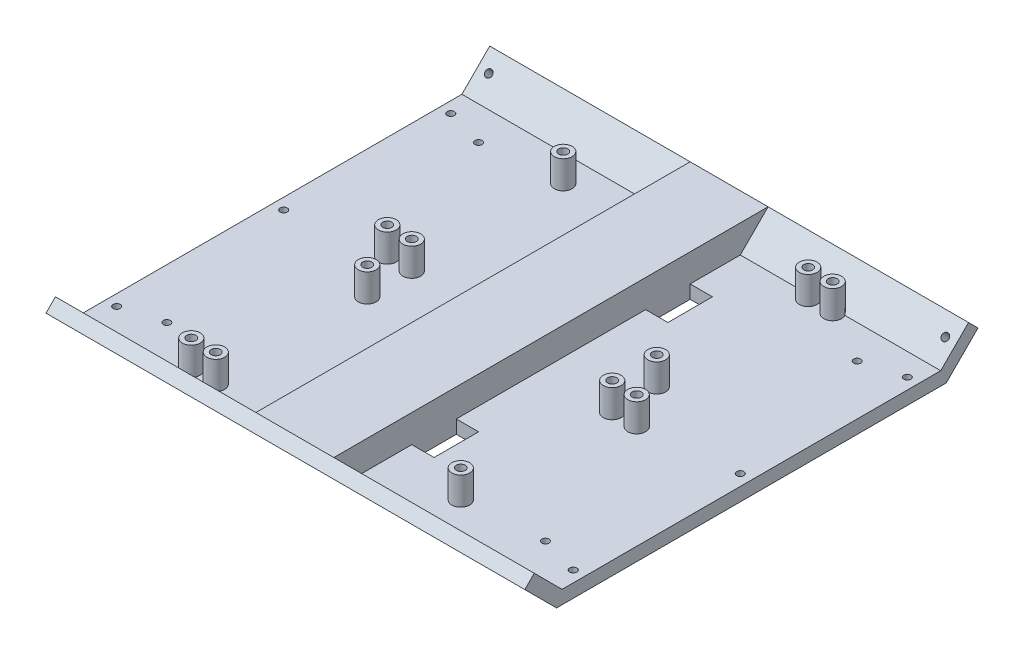
from build123d import *

# Parameters (mm, degrees)
MAIN_DEPTH                                   = 107.5
F_3_0MM_DOWEL_HOLE1_D                        = 3.2
F_3_0MM_DOWEL_HOLE1_ON_FACE_2_D              = 3.2
F_3_0MM_DOWEL_HOLE1_ON_FACE_3_D              = 3.2
F_3_0MM_DOWEL_HOLE1_ON_FACE_4_D              = 3.2
SKETCH4_W                                    = 10
SKETCH4_H                                    = 20
BATTERY_STRAP_CUTOUT_DEPTH                   = 149.539775596
BATTERY_STRAP_CUTOUT_MIRROR_AT_THE_S_2_W     = 10
BATTERY_STRAP_CUTOUT_MIRROR_AT_THE_S_2_H     = 20
BATTERY_STRAP_CUTOUT_MIRROR_AT_THE_S_3_DEPTH = 149.539775596
BATTERY_MOUNT_DEPTH                          = 17.5
PCB_MOUNTS_REACH                             = 151.165
SKETCH7_R                                    = 4
SKETCH8_R                                    = 2.05
PCB_MOUNT_INSERTS_DEPTH                      = 5.7
SKETCH9_R                                    = 1.6
FEET_SCREW_HOLE_DEPTH                        = 150.164556561
MIRROR1_AT_THE_SECOND_PLANE_COPY_1_SKETC_R   = 1.6
MIRROR1_AT_THE_SECOND_PLANE_COPY_1_DEPTH     = 150.164556561


with BuildPart() as part:
    # Sketch2 → Main (new, symmetric)
    with BuildSketch(Plane(origin=(0, 0, 0), x_dir=(0, 0, -1), z_dir=(1, 0, 0))):
        Polygon((-85, 0), (85, 0), (97.5, 12.5), (101.742640687, 8.257359313), (87.485281374, -6), (-87.485281374, -6), (-101.742640687, 8.257359313), (-97.5, 12.5), align=None)
    extrude(amount=MAIN_DEPTH, both=True)

    # Ø3.0mm Dowel Hole1 (through all)
    with Locations(Plane(origin=(-102.5, 7.071067812, -92.071067812), x_dir=(0, 0.707106781187, -0.707106781187), z_dir=(0, 0.707106781187, 0.707106781187))):
        with Locations((0, 0)):
            Hole(F_3_0MM_DOWEL_HOLE1_D / 2)

    # Ø3.0mm Dowel Hole1 on face 2 (through all)
    with Locations(Plane(origin=(-102.5, 0, -75), x_dir=(0, 0, 1), z_dir=(0, 1, 0))):
        with Locations((0, 0), (75, 0), (150, 0), (150, 205), (75, 205), (0, 205)):
            Hole(F_3_0MM_DOWEL_HOLE1_ON_FACE_2_D / 2)

    # Ø3.0mm Dowel Hole1 on face 3 (through all)
    with Locations(Plane(origin=(-102.5, 7.071067812, 92.071067812), x_dir=(0, -0.707106781187, -0.707106781187), z_dir=(0, 0.707106781187, -0.707106781187))):
        with Locations((0, 0), (0, -205)):
            Hole(F_3_0MM_DOWEL_HOLE1_ON_FACE_3_D / 2)

    # Ø3.0mm Dowel Hole1 on face 4 (through all)
    with Locations(Plane(origin=(102.5, 7.071067812, -92.071067812), x_dir=(0, 0.707106781187, -0.707106781187), z_dir=(0, 0.707106781187, 0.707106781187))):
        with Locations((0, 0)):
            Hole(F_3_0MM_DOWEL_HOLE1_ON_FACE_4_D / 2)

    # Sketch4 → Battery strap cutout (cut, through all)
    with BuildSketch(Plane(origin=(0, 0, 0), x_dir=(1, 0, 0), z_dir=(0, 1, 0))):
        with Locations((22.5, 52.5)):
            Rectangle(SKETCH4_W, SKETCH4_H)
    battery_strap_cutout = extrude(amount=-BATTERY_STRAP_CUTOUT_DEPTH, mode=Mode.SUBTRACT)

    # Battery strap cutout mirror: Battery strap cutout across plane
    add(battery_strap_cutout.mirror(Plane(origin=(0, 0, 0), x_dir=(0, 0, 1), z_dir=(1, 0, 0))), mode=Mode.SUBTRACT)

    # Battery strap cutout mirror at the secon: Battery strap cutout across plane
    add(battery_strap_cutout.mirror(Plane.XY), mode=Mode.SUBTRACT)

    # Battery strap cutout mirror at the s 2 → Battery strap cutout mirror at the s 3 (cut, through all)
    with BuildSketch(Plane(origin=(0, 0, 0), x_dir=(-1, 0, 0), z_dir=(0, 1, 0))):
        with Locations((22.5, 52.5)):
            Rectangle(BATTERY_STRAP_CUTOUT_MIRROR_AT_THE_S_2_W, BATTERY_STRAP_CUTOUT_MIRROR_AT_THE_S_2_H)
    extrude(amount=-BATTERY_STRAP_CUTOUT_MIRROR_AT_THE_S_3_DEPTH, mode=Mode.SUBTRACT)

    # Sketch6 → Battery mount (add, symmetric)
    with BuildSketch(Plane(origin=(0, 0, 0), x_dir=(0, 0, -1), z_dir=(1, 0, 0))):
        Polygon((-97.5, 12.5), (97.5, 12.5), (85, 0), (-85, 0), align=None)
    extrude(amount=BATTERY_MOUNT_DEPTH, both=True)

    # PCB mounts: up to this face of the body (flat: up to its plane)
    pcb_mounts_end = Plane(part.part.faces().sort_by_distance((63.510690477, 0, 0))[0])
    # Sketch7 → PCB mounts (add, up to the picked face)
    with BuildSketch(Plane(origin=(0, 12.5, 0), x_dir=(1, 0, 0), z_dir=(0, 1, 0)), mode=Mode.PRIVATE) as pcb_mounts_sk1:
        with Locations(Location((-50, -15, 0), (0, 0, 270))):
            Circle(SKETCH7_R)
    pcb_mounts_tool1 = split(extrude(pcb_mounts_sk1.sketch, amount=-PCB_MOUNTS_REACH, mode=Mode.PRIVATE), bisect_by=pcb_mounts_end, keep=Keep.BOTH, mode=Mode.PRIVATE)
    # Sketch7 → PCB mounts (add, up to the picked face)
    with BuildSketch(Plane(origin=(0, 12.5, 0), x_dir=(1, 0, 0), z_dir=(0, 1, 0)), mode=Mode.PRIVATE) as pcb_mounts_sk2:
        with Locations(Location((-50, -83, 0), (0, 0, 270))):
            Circle(SKETCH7_R)
    pcb_mounts_tool2 = split(extrude(pcb_mounts_sk2.sketch, amount=-PCB_MOUNTS_REACH, mode=Mode.PRIVATE), bisect_by=pcb_mounts_end, keep=Keep.BOTH, mode=Mode.PRIVATE)
    # Sketch7 → PCB mounts (add, up to the picked face)
    with BuildSketch(Plane(origin=(0, 12.5, 0), x_dir=(1, 0, 0), z_dir=(0, 1, 0)), mode=Mode.PRIVATE) as pcb_mounts_sk3:
        with Locations(Location((-61, -83, 0), (0, 0, 270))):
            Circle(SKETCH7_R)
    pcb_mounts_tool3 = split(extrude(pcb_mounts_sk3.sketch, amount=-PCB_MOUNTS_REACH, mode=Mode.PRIVATE), bisect_by=pcb_mounts_end, keep=Keep.BOTH, mode=Mode.PRIVATE)
    # Sketch7 → PCB mounts (add, up to the picked face)
    with BuildSketch(Plane(origin=(0, 12.5, 0), x_dir=(1, 0, 0), z_dir=(0, 1, 0)), mode=Mode.PRIVATE) as pcb_mounts_sk4:
        with Locations(Location((-50, 73, 0), (0, 0, 270))):
            Circle(SKETCH7_R)
    pcb_mounts_tool4 = split(extrude(pcb_mounts_sk4.sketch, amount=-PCB_MOUNTS_REACH, mode=Mode.PRIVATE), bisect_by=pcb_mounts_end, keep=Keep.BOTH, mode=Mode.PRIVATE)
    # Sketch7 → PCB mounts (add, up to the picked face)
    with BuildSketch(Plane(origin=(0, 12.5, 0), x_dir=(1, 0, 0), z_dir=(0, 1, 0)), mode=Mode.PRIVATE) as pcb_mounts_sk5:
        with Locations(Location((-50, 5, 0), (0, 0, 270))):
            Circle(SKETCH7_R)
    pcb_mounts_tool5 = split(extrude(pcb_mounts_sk5.sketch, amount=-PCB_MOUNTS_REACH, mode=Mode.PRIVATE), bisect_by=pcb_mounts_end, keep=Keep.BOTH, mode=Mode.PRIVATE)
    # Sketch7 → PCB mounts (add, up to the picked face)
    with BuildSketch(Plane(origin=(0, 12.5, 0), x_dir=(1, 0, 0), z_dir=(0, 1, 0)), mode=Mode.PRIVATE) as pcb_mounts_sk6:
        with Locations(Location((-61, 5, 0), (0, 0, 270))):
            Circle(SKETCH7_R)
    pcb_mounts_tool6 = split(extrude(pcb_mounts_sk6.sketch, amount=-PCB_MOUNTS_REACH, mode=Mode.PRIVATE), bisect_by=pcb_mounts_end, keep=Keep.BOTH, mode=Mode.PRIVATE)
    # Sketch7 → PCB mounts (add, up to the picked face)
    with BuildSketch(Plane(origin=(0, 12.5, 0), x_dir=(1, 0, 0), z_dir=(0, 1, 0)), mode=Mode.PRIVATE) as pcb_mounts_sk7:
        with Locations(Location((61, 83, 0), (0, 0, 270))):
            Circle(SKETCH7_R)
    pcb_mounts_tool7 = split(extrude(pcb_mounts_sk7.sketch, amount=-PCB_MOUNTS_REACH, mode=Mode.PRIVATE), bisect_by=pcb_mounts_end, keep=Keep.BOTH, mode=Mode.PRIVATE)
    # Sketch7 → PCB mounts (add, up to the picked face)
    with BuildSketch(Plane(origin=(0, 12.5, 0), x_dir=(1, 0, 0), z_dir=(0, 1, 0)), mode=Mode.PRIVATE) as pcb_mounts_sk8:
        with Locations(Location((50, 83, 0), (0, 0, 270))):
            Circle(SKETCH7_R)
    pcb_mounts_tool8 = split(extrude(pcb_mounts_sk8.sketch, amount=-PCB_MOUNTS_REACH, mode=Mode.PRIVATE), bisect_by=pcb_mounts_end, keep=Keep.BOTH, mode=Mode.PRIVATE)
    # Sketch7 → PCB mounts (add, up to the picked face)
    with BuildSketch(Plane(origin=(0, 12.5, 0), x_dir=(1, 0, 0), z_dir=(0, 1, 0)), mode=Mode.PRIVATE) as pcb_mounts_sk9:
        with Locations(Location((50, 15, 0), (0, 0, 270))):
            Circle(SKETCH7_R)
    pcb_mounts_tool9 = split(extrude(pcb_mounts_sk9.sketch, amount=-PCB_MOUNTS_REACH, mode=Mode.PRIVATE), bisect_by=pcb_mounts_end, keep=Keep.BOTH, mode=Mode.PRIVATE)
    # Sketch7 → PCB mounts (add, up to the picked face)
    with BuildSketch(Plane(origin=(0, 12.5, 0), x_dir=(1, 0, 0), z_dir=(0, 1, 0)), mode=Mode.PRIVATE) as pcb_mounts_sk10:
        with Locations(Location((61, -5, 0), (0, 0, 270))):
            Circle(SKETCH7_R)
    pcb_mounts_tool10 = split(extrude(pcb_mounts_sk10.sketch, amount=-PCB_MOUNTS_REACH, mode=Mode.PRIVATE), bisect_by=pcb_mounts_end, keep=Keep.BOTH, mode=Mode.PRIVATE)
    # Sketch7 → PCB mounts (add, up to the picked face)
    with BuildSketch(Plane(origin=(0, 12.5, 0), x_dir=(1, 0, 0), z_dir=(0, 1, 0)), mode=Mode.PRIVATE) as pcb_mounts_sk11:
        with Locations(Location((50, -5, 0), (0, 0, 270))):
            Circle(SKETCH7_R)
    pcb_mounts_tool11 = split(extrude(pcb_mounts_sk11.sketch, amount=-PCB_MOUNTS_REACH, mode=Mode.PRIVATE), bisect_by=pcb_mounts_end, keep=Keep.BOTH, mode=Mode.PRIVATE)
    # Sketch7 → PCB mounts (add, up to the picked face)
    with BuildSketch(Plane(origin=(0, 12.5, 0), x_dir=(1, 0, 0), z_dir=(0, 1, 0)), mode=Mode.PRIVATE) as pcb_mounts_sk12:
        with Locations(Location((50, -73, 0), (0, 0, 270))):
            Circle(SKETCH7_R)
    pcb_mounts_tool12 = split(extrude(pcb_mounts_sk12.sketch, amount=-PCB_MOUNTS_REACH, mode=Mode.PRIVATE), bisect_by=pcb_mounts_end, keep=Keep.BOTH, mode=Mode.PRIVATE)
    add(pcb_mounts_tool1.solids().sort_by(Axis((-50, 12.5, 15), (0, -1, 0)))[0])
    add(pcb_mounts_tool2.solids().sort_by(Axis((-50, 12.5, 83), (0, -1, 0)))[0])
    add(pcb_mounts_tool3.solids().sort_by(Axis((-61, 12.5, 83), (0, -1, 0)))[0])
    add(pcb_mounts_tool4.solids().sort_by(Axis((-50, 12.5, -73), (0, -1, 0)))[0])
    add(pcb_mounts_tool5.solids().sort_by(Axis((-50, 12.5, -5), (0, -1, 0)))[0])
    add(pcb_mounts_tool6.solids().sort_by(Axis((-61, 12.5, -5), (0, -1, 0)))[0])
    add(pcb_mounts_tool7.solids().sort_by(Axis((61, 12.5, -83), (0, -1, 0)))[0])
    add(pcb_mounts_tool8.solids().sort_by(Axis((50, 12.5, -83), (0, -1, 0)))[0])
    add(pcb_mounts_tool9.solids().sort_by(Axis((50, 12.5, -15), (0, -1, 0)))[0])
    add(pcb_mounts_tool10.solids().sort_by(Axis((61, 12.5, 5), (0, -1, 0)))[0])
    add(pcb_mounts_tool11.solids().sort_by(Axis((50, 12.5, 5), (0, -1, 0)))[0])
    add(pcb_mounts_tool12.solids().sort_by(Axis((50, 12.5, 73), (0, -1, 0)))[0])

    # Sketch8 → PCB mount inserts (cut)
    with BuildSketch(Plane(origin=(0, 12.5, 0), x_dir=(1, 0, 0), z_dir=(0, 1, 0))):
        with Locations(Location((-50, 73, 0), (0, 0, 270))):
            Circle(SKETCH8_R)
        with Locations(Location((-50, 5, 0), (0, 0, 270))):
            Circle(SKETCH8_R)
        with Locations(Location((-61, 5, 0), (0, 0, 270))):
            Circle(SKETCH8_R)
        with Locations(Location((-50, -15, 0), (0, 0, 270))):
            Circle(SKETCH8_R)
        with Locations(Location((-61, -83, 0), (0, 0, 270))):
            Circle(SKETCH8_R)
        with Locations(Location((-50, -83, 0), (0, 0, 270))):
            Circle(SKETCH8_R)
        with Locations(Location((50, -73, 0), (0, 0, 270))):
            Circle(SKETCH8_R)
        with Locations(Location((61, -5, 0), (0, 0, 270))):
            Circle(SKETCH8_R)
        with Locations(Location((50, -5, 0), (0, 0, 270))):
            Circle(SKETCH8_R)
        with Locations(Location((50, 15, 0), (0, 0, 270))):
            Circle(SKETCH8_R)
        with Locations(Location((61, 83, 0), (0, 0, 270))):
            Circle(SKETCH8_R)
        with Locations(Location((50, 83, 0), (0, 0, 270))):
            Circle(SKETCH8_R)
    extrude(amount=-PCB_MOUNT_INSERTS_DEPTH, mode=Mode.SUBTRACT)

    # Sketch9 → Feet screw hole (cut, through all)
    with BuildSketch(Plane.XZ.offset(6)):
        with Locations(Location((85, 70, 0), (0, 0, 270))):
            Circle(SKETCH9_R)
    feet_screw_hole = extrude(amount=-FEET_SCREW_HOLE_DEPTH, mode=Mode.SUBTRACT)

    # Mirror1: Feet screw hole across plane
    add(feet_screw_hole.mirror(Plane.XY), mode=Mode.SUBTRACT)

    # Mirror1 at the second plane: Feet screw hole across plane
    add(feet_screw_hole.mirror(Plane(origin=(0, 0, 0), x_dir=(0, 0, 1), z_dir=(1, 0, 0))), mode=Mode.SUBTRACT)

    # Mirror1 at the second plane copy 1 sketc → Mirror1 at the second plane copy 1 (cut, through all)
    with BuildSketch(Plane(origin=(0, -6, 0), x_dir=(-1, 0, 0), z_dir=(0, -1, 0))):
        with Locations(Location((85, 70, 0), (0, 0, 270))):
            Circle(MIRROR1_AT_THE_SECOND_PLANE_COPY_1_SKETC_R)
    extrude(amount=-MIRROR1_AT_THE_SECOND_PLANE_COPY_1_DEPTH, mode=Mode.SUBTRACT)


solid = part.part
